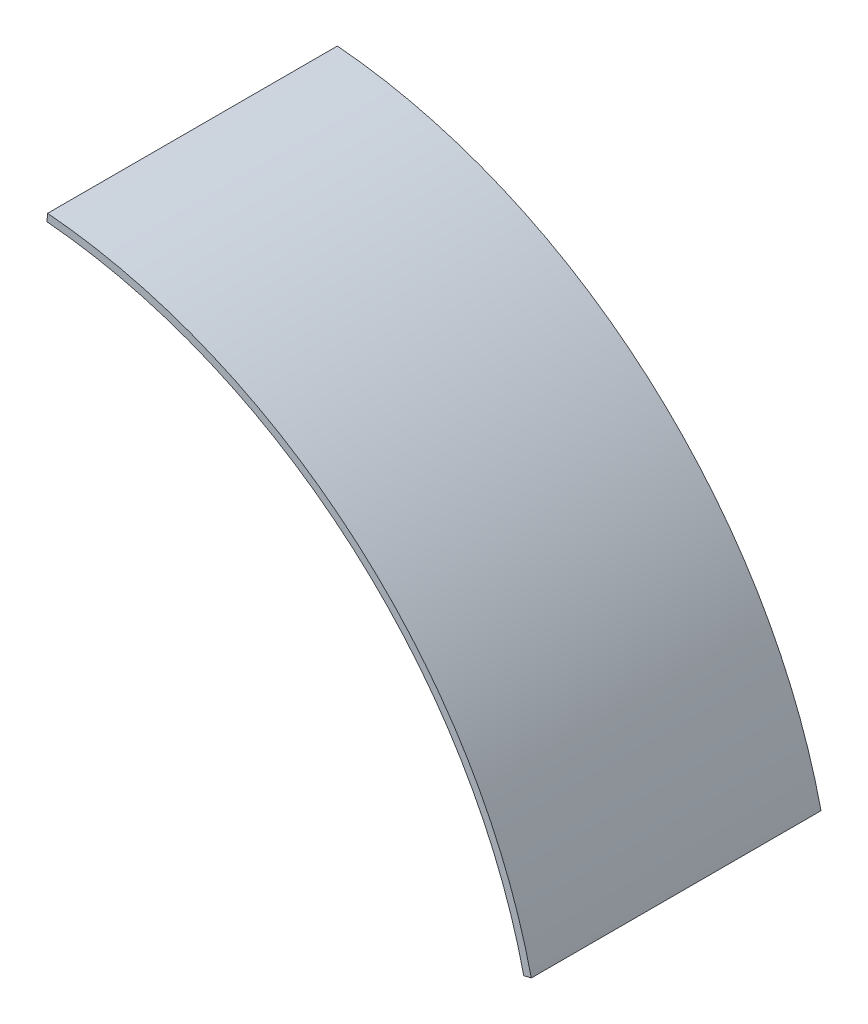
from build123d import *

# Parameters (mm, degrees)
EXTRUDE_1_DEPTH = 375


with BuildPart() as part:
    # 草图1 → 凸台-拉伸1 (new body)
    with BuildSketch(Plane.XY):
        with BuildLine():
            Line((61.05402349, 702.351341008), (60.188008972, 692.388910639))
            ThreePointArc((60.188008972, 692.388910639), (455.961025148, 524.523158255), (677.274077507, 155.96417517))
            Line((677.274077507, 155.96417517), (687.019028263, 158.208264022))
            ThreePointArc((687.019028263, 158.208264022), (462.521615438, 532.070254057), (61.05402349, 702.351341008))
        make_face()
    extrude(amount=-EXTRUDE_1_DEPTH)


solid = part.part
